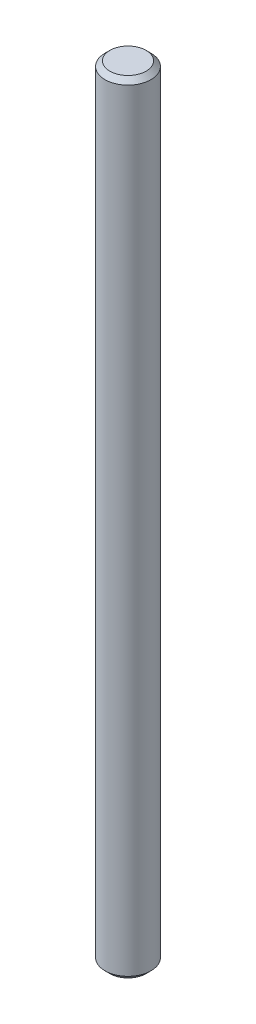
from build123d import *

# Parameters (mm, degrees)
SKETCH1_R           = 2.35
BOSS_EXTRUDE1_DEPTH = 80
CHAMFER1_SIZE       = 0.5


with BuildPart() as part:
    # Sketch1 → Boss-Extrude1 (new body)
    with BuildSketch(Plane(origin=(0, 0, 0), x_dir=(1, 0, 0), z_dir=(0, 1, 0))):
        with Locations(Location((0, 0, 0), (0, 0, 270))):
            Circle(SKETCH1_R)
    extrude(amount=BOSS_EXTRUDE1_DEPTH)

    # Chamfer1
    chamfer1_edges = [part.edges().sort_by_distance(p)[0] for p in [
        (0, 0, -2.35),
        (0, 80, -2.35),
    ]]
    chamfer(chamfer1_edges, length=CHAMFER1_SIZE)


solid = part.part
